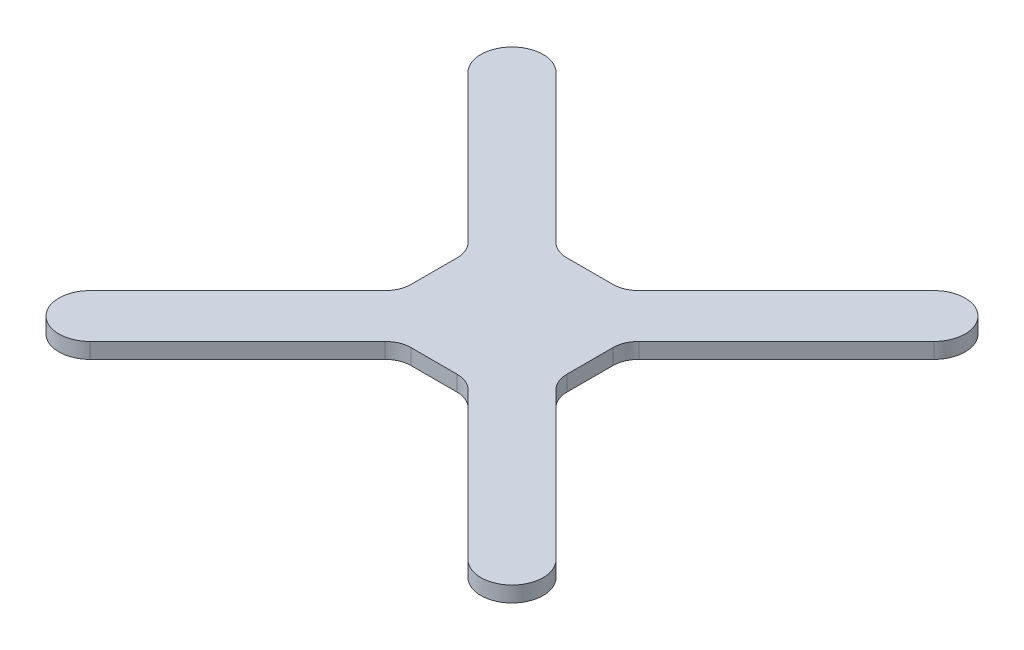
from build123d import *

# Parameters (mm, degrees)
BOSS_EXTRUDE1_DEPTH = 6
FILLET1_R           = 10


with BuildPart() as part:
    # Sketch1 → Boss-Extrude1 (new body)
    with BuildSketch(Plane(origin=(0, 0, 0), x_dir=(1, 0, 0), z_dir=(0, 1, 0))):
        with BuildLine():
            Line((-72.831998462, 89.802561211), (-13.029437252, 30))
            Line((-13.029437252, 30), (13.029437252, 30))
            Line((13.029437252, 30), (72.831998462, 89.802561211))
            ThreePointArc((72.831998462, 89.802561211), (89.802561211, 89.802561211), (89.802561211, 72.831998462))
            Line((89.802561211, 72.831998462), (30, 13.029437252))
            Line((30, 13.029437252), (30, -13.029437252))
            Line((30, -13.029437252), (89.802561211, -72.831998462))
            ThreePointArc((89.802561211, -72.831998462), (89.802561211, -89.802561211), (72.831998462, -89.802561211))
            Line((72.831998462, -89.802561211), (13.029437252, -30))
            Line((13.029437252, -30), (-13.029437252, -30))
            Line((-13.029437252, -30), (-72.831998462, -89.802561211))
            ThreePointArc((-72.831998462, -89.802561211), (-89.802561211, -89.802561211), (-89.802561211, -72.831998462))
            Line((-89.802561211, -72.831998462), (-30, -13.029437252))
            Line((-30, -13.029437252), (-30, 13.029437252))
            Line((-30, 13.029437252), (-89.802561211, 72.831998462))
            ThreePointArc((-89.802561211, 72.831998462), (-89.802561211, 89.802561211), (-72.831998462, 89.802561211))
        make_face()
    extrude(amount=BOSS_EXTRUDE1_DEPTH)

    # Fillet1
    fillet1_edges = [part.edges().sort_by_distance(p)[0] for p in [
        (-13.029437252, 3, -30),
        (13.029437252, 3, -30),
        (30, 3, -13.029437252),
        (30, 3, 13.029437252),
        (13.029437252, 3, 30),
        (-13.029437252, 3, 30),
        (-30, 3, 13.029437252),
        (-30, 3, -13.029437252),
    ]]
    fillet(fillet1_edges, radius=FILLET1_R)


solid = part.part
